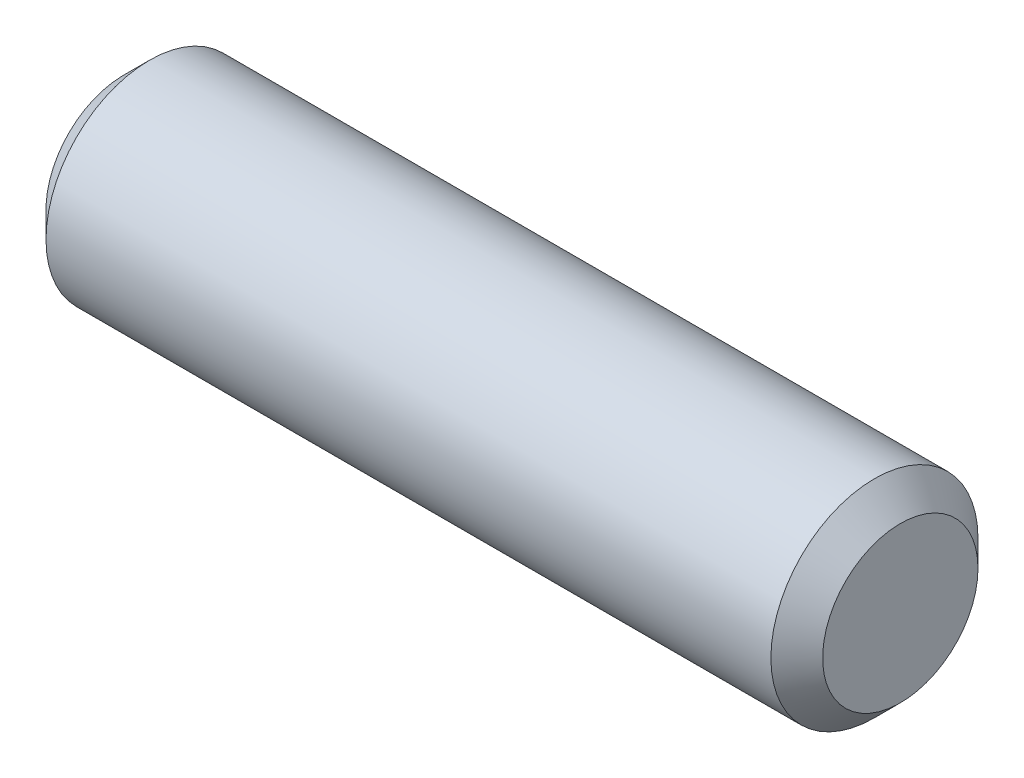
from build123d import *

# Parameters (mm, degrees)
SCHIZZO2_R                   = 4
ESTRUSIONE_ESTRUSIONE1_DEPTH = 15
SMUSSO1_SIZE                 = 1


with BuildPart() as part:
    # Schizzo2 → Estrusione-Estrusione1 (new, symmetric)
    with BuildSketch(Plane(origin=(0, 0, 0), x_dir=(0, 0, -1), z_dir=(1, 0, 0))):
        Circle(SCHIZZO2_R)
    extrude(amount=ESTRUSIONE_ESTRUSIONE1_DEPTH, both=True)

    # Smusso1
    smusso1_edges = [part.edges().sort_by_distance(p)[0] for p in [
        (-15, 0, 4),
        (15, 0, 4),
    ]]
    chamfer(smusso1_edges, length=SMUSSO1_SIZE)


solid = part.part
